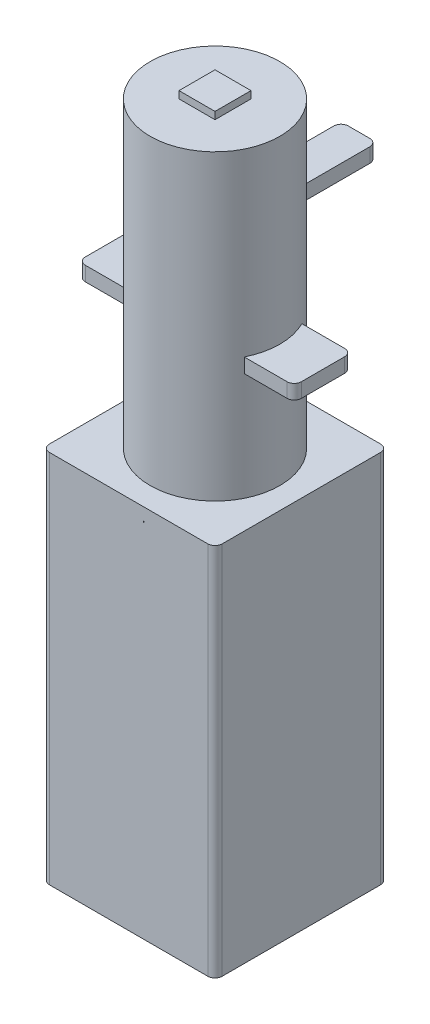
from build123d import *

# Parameters (mm, degrees)
SKETCH1_W            = 24
SKETCH1_H            = 24
SKETCH1_W_2          = 20
SKETCH1_H_2          = 20
BOSS_EXTRUDE1_DEPTH  = 50
FILLET1_R            = 1
FILLET2_R            = 1
BOSS_EXTRUDE7_START  = 2
BOSS_EXTRUDE7_DEPTH  = 2
SKETCH9_R            = 9
BOSS_EXTRUDE9_DEPTH  = 30
SKETCH10_R           = 7
CUT_EXTRUDE1_DEPTH   = 34
SKETCH11_R           = 9
SKETCH11_R_2         = 7
BOSS_EXTRUDE10_DEPTH = 40
BOSS_EXTRUDE12_DEPTH = 1
FILLET3_R            = 1
SKETCH15_R           = 9
BOSS_EXTRUDE13_DEPTH = 2
BOSS_EXTRUDE15_DEPTH = 1
FILLET5_R            = 1
SKETCH18_W           = 5
SKETCH18_H           = 5
BOSS_EXTRUDE16_DEPTH = 1


with BuildPart() as part:
    # Sketch1 → Boss-Extrude1 (new body)
    with BuildSketch(Plane(origin=(0, 0, 0), x_dir=(1, 0, 0), z_dir=(0, 1, 0))):
        with Locations((-0.433212996, -2.166064982)):
            Rectangle(SKETCH1_W, SKETCH1_H)
        with Locations((-0.433212996, -2.166064982)):
            Rectangle(SKETCH1_W_2, SKETCH1_H_2, mode=Mode.SUBTRACT)
    extrude(amount=BOSS_EXTRUDE1_DEPTH)

    # Fillet1
    fillet1_edges = [part.edges().sort_by_distance(p)[0] for p in [
        (-10.433212996, 25, -7.833935018),
        (11.566787004, 25, -9.833935018),
        (11.566787004, 25, 14.166064982),
        (-12.433212996, 25, 14.166064982),
    ]]
    fillet(fillet1_edges, radius=FILLET1_R)

    # Fillet2
    fillet2_edges = [part.edges().sort_by_distance(p)[0] for p in [
        (-12.433212996, 25, -9.833935018),
    ]]
    fillet(fillet2_edges, radius=FILLET2_R)

    # Sketch8 → Boss-Extrude7 (add)
    with BuildSketch(Plane(origin=(0, 50, 0), x_dir=(1, 0, 0), z_dir=(0, 1, 0)).offset(BOSS_EXTRUDE7_START)):
        with BuildLine():
            Line((10.566787004, 9.833935018), (-11.433212996, 9.833935018))
            ThreePointArc((-11.433212996, 9.833935018), (-12.140319778, 9.541041799), (-12.433212996, 8.833935018))
            Line((-12.433212996, 8.833935018), (-12.433212996, -13.166064982))
            ThreePointArc((-12.433212996, -13.166064982), (-12.140319778, -13.873171763), (-11.433212996, -14.166064982))
            Line((-11.433212996, -14.166064982), (10.566787004, -14.166064982))
            ThreePointArc((10.566787004, -14.166064982), (11.273893785, -13.873171763), (11.566787004, -13.166064982))
            Line((11.566787004, -13.166064982), (11.566787004, 8.833935018))
            ThreePointArc((11.566787004, 8.833935018), (11.273893785, 9.541041799), (10.566787004, 9.833935018))
        make_face()
    extrude(amount=-BOSS_EXTRUDE7_DEPTH)

    # Sketch9 → Boss-Extrude9 (add)
    with BuildSketch(Plane.XZ.offset(-50)):
        with Locations(Location((-0.433212996, 2.166064982, 0), (0, 0, 90))):
            Circle(SKETCH9_R)
    extrude(amount=BOSS_EXTRUDE9_DEPTH)

    # Sketch10 → Cut-Extrude1 (cut)
    with BuildSketch(Plane.XZ.offset(-20)):
        with Locations(Location((-0.433212996, 2.166064982, 0), (0, 0, 270))):
            Circle(SKETCH10_R)
    extrude(amount=-CUT_EXTRUDE1_DEPTH, mode=Mode.SUBTRACT)

    # Sketch11 → Boss-Extrude10 (add)
    with BuildSketch(Plane(origin=(0, 52, 0), x_dir=(1, 0, 0), z_dir=(0, 1, 0))):
        with Locations(Location((-0.433212996, -2.166064982, 0), (0, 0, 270))):
            Circle(SKETCH11_R)
        with Locations(Location((-0.433212996, -2.166064982, 0), (0, 0, 90))):
            Circle(SKETCH11_R_2, mode=Mode.SUBTRACT)
    extrude(amount=BOSS_EXTRUDE10_DEPTH)

    # Sketch14 → Boss-Extrude12 (add, symmetric)
    with BuildSketch(Plane(origin=(0, 68, 0), x_dir=(1, 0, 0), z_dir=(0, 1, 0))):
        with BuildLine():
            ThreePointArc((-8.495470745, -6.166064982), (-9.433212996, -2.166064982), (-8.495470745, 1.833935018))
            Line((-8.495470745, 1.833935018), (-15.433212996, 1.833935018))
            Line((-15.433212996, 1.833935018), (-15.433212996, -6.166064982))
            Line((-15.433212996, -6.166064982), (-8.495470745, -6.166064982))
        make_face()
        with BuildLine():
            Line((14.566787004, 1.833935018), (7.629044752, 1.833935018))
            ThreePointArc((7.629044752, 1.833935018), (8.329215883, -0.111840035), (8.566787004, -2.166064982))
            ThreePointArc((8.566787004, -2.166064982), (8.329215883, -4.220289929), (7.629044752, -6.166064982))
            Line((7.629044752, -6.166064982), (14.566787004, -6.166064982))
            Line((14.566787004, -6.166064982), (14.566787004, 1.833935018))
        make_face()
    extrude(amount=BOSS_EXTRUDE12_DEPTH, both=True)

    # Fillet3
    fillet3_edges = [part.edges().sort_by_distance(p)[0] for p in [
        (-15.433212996, 68, -1.833935018),
        (-15.433212996, 68, 6.166064982),
        (14.566787004, 68, 6.166064982),
        (14.566787004, 68, -1.833935018),
    ]]
    fillet(fillet3_edges, radius=FILLET3_R)

    # Sketch15 → Boss-Extrude13 (add)
    with BuildSketch(Plane(origin=(0, 92, 0), x_dir=(1, 0, 0), z_dir=(0, 1, 0))):
        with Locations(Location((-0.433212996, -2.166064982, 0), (0, 0, 270))):
            Circle(SKETCH15_R)
    extrude(amount=BOSS_EXTRUDE13_DEPTH)

    # Sketch17 → Boss-Extrude15 (add, symmetric)
    with BuildSketch(Plane(origin=(0, 79, 0), x_dir=(1, 0, 0), z_dir=(0, 1, 0))):
        with BuildLine():
            Line((2.066787004, 17.833935018), (-2.933212996, 17.833935018))
            Line((-2.933212996, 17.833935018), (-2.933212996, 6.479743251))
            ThreePointArc((-2.933212996, 6.479743251), (-0.433212996, 6.833935018), (2.066787004, 6.479743251))
            Line((2.066787004, 6.479743251), (2.066787004, 17.833935018))
        make_face()
    extrude(amount=BOSS_EXTRUDE15_DEPTH, both=True)

    # Fillet5
    fillet5_edges = [part.edges().sort_by_distance(p)[0] for p in [
        (2.066787004, 79, -17.833935018),
        (-2.933212996, 79, -17.833935018),
    ]]
    fillet(fillet5_edges, radius=FILLET5_R)

    # Sketch18 → Boss-Extrude16 (add, symmetric)
    with BuildSketch(Plane(origin=(0, 94, 0), x_dir=(1, 0, 0), z_dir=(0, 1, 0))):
        with Locations((-0.433212996, -2.166064982)):
            Rectangle(SKETCH18_W, SKETCH18_H)
    extrude(amount=BOSS_EXTRUDE16_DEPTH, both=True)


solid = part.part
